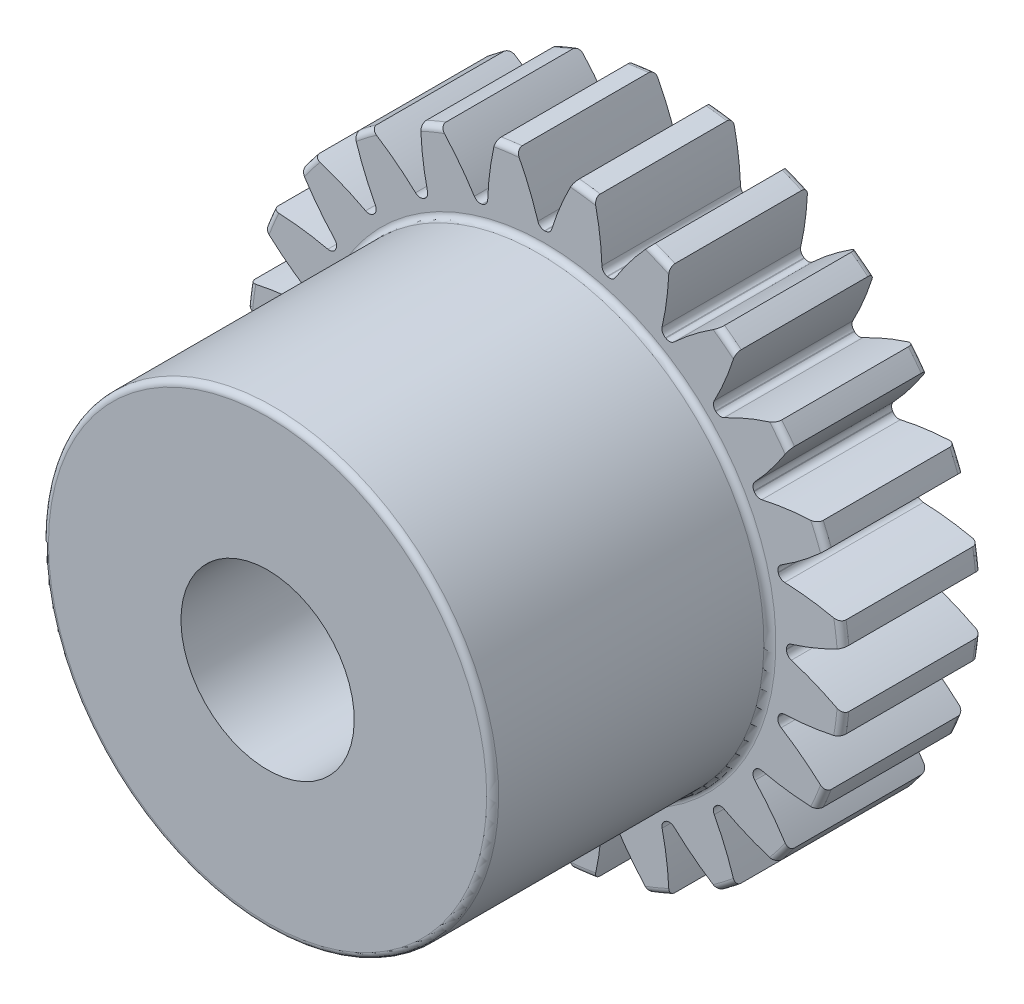
from build123d import *

# Parameters (mm, degrees)
FILLET2_R          = 0.13716
CUT_EXTRUDE2_DEPTH = 12.59253346
CIRPATTERN1_COUNT  = 24


with BuildPart() as part:
    # Sketch4 → Revolve1 (revolve)
    with BuildSketch(Plane(origin=(0, 0, 0), x_dir=(0, 0, -1), z_dir=(1, 0, 0))):
        Polygon((-9.525, 1.984375), (-9.525, 5.1562), (-3.175, 5.1562), (-3.175, 6.858), (0, 6.858), (0, 1.984375), align=None)
    revolve(axis=Axis((0, 0, 3.175), (0, 0, 1)))

    # Fillet2
    fillet2_edges = [part.edges().sort_by_distance(p)[0] for p in [
        (0, -6.858, 0),
        (0, -6.858, 3.175),
        (0, -5.1562, 3.175),
        (0, -5.1562, 9.525),
    ]]
    fillet(fillet2_edges, radius=FILLET2_R)

    # Sketch7 → Cut-Extrude2 (cut, through all)
    with BuildSketch(Plane.XY.offset(3.175)):
        with BuildLine():
            ThreePointArc((-0.006638177, 5.535079353), (0, 5.535083333), (0.006638177, 5.535079353))
            ThreePointArc((0.006638177, 5.535079353), (0.101064897, 5.566072457), (0.158563966, 5.647133144))
            ThreePointArc((0.158563966, 5.647133144), (0.377797664, 6.249396839), (0.656625515, 6.826493019))
            ThreePointArc((0.656625515, 6.826493019), (0, 6.858), (-0.656625515, 6.826493019))
            ThreePointArc((-0.656625515, 6.826493019), (-0.377797664, 6.249396839), (-0.158563966, 5.647133144))
            ThreePointArc((-0.158563966, 5.647133144), (-0.101064897, 5.566072457), (-0.006638177, 5.535079353))
        make_face()
    cut_extrude2 = extrude(amount=-CUT_EXTRUDE2_DEPTH, mode=Mode.SUBTRACT)

    # CirPattern1: Cut-Extrude2 ×24 about axis
    cirpattern1_axis = Axis((0, 0, 0), (0, 0, 1))
    for i in range(1, CIRPATTERN1_COUNT):
        add(cut_extrude2.rotate(cirpattern1_axis, i * 360 / CIRPATTERN1_COUNT), mode=Mode.SUBTRACT)


solid = part.part
